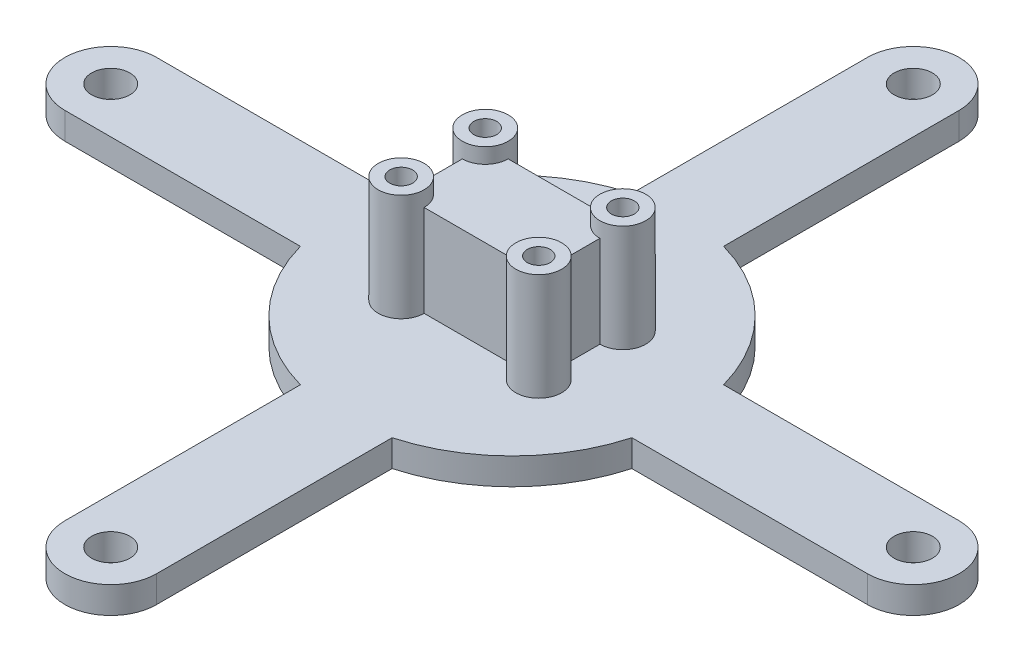
from build123d import *
from build123d.topology import SkipClean

# Parameters (mm, degrees)
SKETCH1_R           = 2.5
BOSS_EXTRUDE1_DEPTH = 3.5
SKETCH4_R           = 1.5
BOSS_EXTRUDE2_DEPTH = 14
CUT_EXTRUDE4_START  = -2
CUT_EXTRUDE4_DEPTH  = 2
CUT_EXTRUDE2_START  = -10
SKETCH4_2_R         = 1.5
CUT_EXTRUDE2_DEPTH  = 10


with BuildPart() as part:
    # Sketch1 → Boss-Extrude1 (new body)
    with BuildSketch(Plane(origin=(0, 0, 0), x_dir=(1, 0, 0), z_dir=(0, 1, 0))):
        with BuildLine():
            Line((-21.685248442, 6), (-52.5, 6))
            ThreePointArc((-52.5, 6), (-58.5, 0), (-52.5, -6))
            Line((-52.5, -6), (-21.685248442, -6))
            ThreePointArc((-21.685248442, -6), (-15.909902577, -15.909902577), (-6, -21.685248442))
            Line((-6, -21.685248442), (-6, -52.5))
            ThreePointArc((-6, -52.5), (0, -58.5), (6, -52.5))
            Line((6, -52.5), (6, -21.685248442))
            ThreePointArc((6, -21.685248442), (15.909902577, -15.909902577), (21.685248442, -6))
            Line((21.685248442, -6), (52.5, -6))
            ThreePointArc((52.5, -6), (58.5, 0), (52.5, 6))
            Line((52.5, 6), (21.685248442, 6))
            ThreePointArc((21.685248442, 6), (15.909902577, 15.909902577), (6, 21.685248442))
            Line((6, 21.685248442), (6, 52.5))
            ThreePointArc((6, 52.5), (0, 58.5), (-6, 52.5))
            Line((-6, 52.5), (-6, 21.685248442))
            ThreePointArc((-6, 21.685248442), (-15.909902577, 15.909902577), (-21.685248442, 6))
        make_face()
        with Locations((0, -52.5)):
            Circle(SKETCH1_R, mode=Mode.SUBTRACT)
        with Locations((52.5, 0)):
            Circle(SKETCH1_R, mode=Mode.SUBTRACT)
        with Locations((-52.5, 0)):
            Circle(SKETCH1_R, mode=Mode.SUBTRACT)
        with Locations((0, 52.5)):
            Circle(SKETCH1_R, mode=Mode.SUBTRACT)
    extrude(amount=BOSS_EXTRUDE1_DEPTH)

    # Sketch4 → Boss-Extrude2 (add)
    with BuildSketch(Plane(origin=(0, 3.5, 0), x_dir=(1, 0, 0), z_dir=(0, 1, 0))):
        with BuildLine():
            Line((-6, -5.5), (6, -5.5))
            ThreePointArc((6, -5.5), (11.121320344, -7.621320344), (9, -2.5))
            Line((9, -2.5), (9, 2.5))
            ThreePointArc((9, 2.5), (11.121320344, 7.621320344), (6, 5.5))
            Line((6, 5.5), (-6, 5.5))
            ThreePointArc((-6, 5.5), (-11.121320344, 7.621320344), (-9, 2.5))
            Line((-9, 2.5), (-9, -2.5))
            ThreePointArc((-9, -2.5), (-11.121320344, -7.621320344), (-6, -5.5))
        make_face()
        with Locations((9, -5.5)):
            Circle(SKETCH4_R, mode=Mode.SUBTRACT)
        with Locations((-9, -5.5)):
            Circle(SKETCH4_R, mode=Mode.SUBTRACT)
        with Locations((-9, 5.5)):
            Circle(SKETCH4_R, mode=Mode.SUBTRACT)
        with Locations((9, 5.5)):
            Circle(SKETCH4_R, mode=Mode.SUBTRACT)
    extrude(amount=BOSS_EXTRUDE2_DEPTH)

    # Sketch6 → Cut-Extrude4 (cut)
    with SkipClean():  # the faces are left unmerged after this step: merging them gives an invalid solid
        with BuildSketch(Plane(origin=(0, 17.5, 0), x_dir=(1, 0, 0), z_dir=(0, 1, 0)).offset(CUT_EXTRUDE4_START)):
            with BuildLine():
                ThreePointArc((9, 2.5), (6.878679656, 3.378679656), (6, 5.5))
                Line((6, 5.5), (-6, 5.5))
                ThreePointArc((-6, 5.5), (-6.878679656, 3.378679656), (-9, 2.5))
                Line((-9, 2.5), (-9, -2.5))
                ThreePointArc((-9, -2.5), (-6.878679656, -3.378679656), (-6, -5.5))
                Line((-6, -5.5), (6, -5.5))
                ThreePointArc((6, -5.5), (6.878679656, -3.378679656), (9, -2.5))
                Line((9, -2.5), (9, 2.5))
            make_face()
        extrude(amount=CUT_EXTRUDE4_DEPTH, mode=Mode.SUBTRACT)

    # Sketch4<2> → Cut-Extrude2 (cut)
    with SkipClean():  # the faces are left unmerged after this step: merging them gives an invalid solid
        with BuildSketch(Plane(origin=(0, 3.5, 0), x_dir=(1, 0, 0), z_dir=(0, 1, 0)).offset(CUT_EXTRUDE2_START)):
            with Locations((9, -5.5)):
                Circle(SKETCH4_2_R)
            with Locations((-9, -5.5)):
                Circle(SKETCH4_2_R)
            with Locations((-9, 5.5)):
                Circle(SKETCH4_2_R)
            with Locations((9, 5.5)):
                Circle(SKETCH4_2_R)
        extrude(amount=CUT_EXTRUDE2_DEPTH, mode=Mode.SUBTRACT)


solid = part.part
